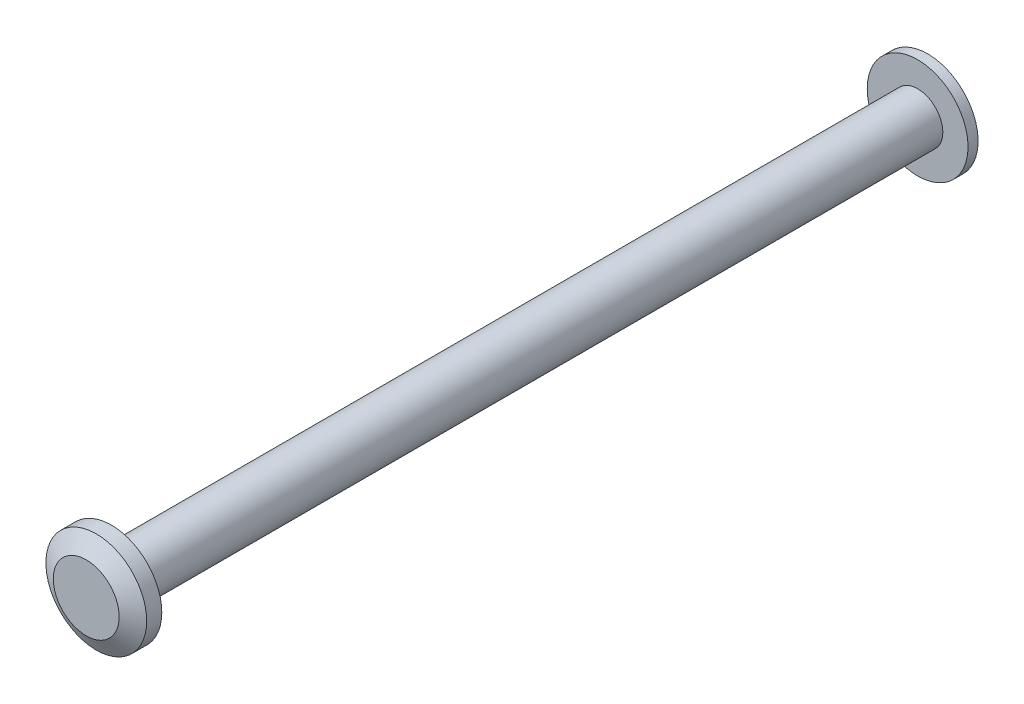
from build123d import *

# Parameters (mm, degrees)
SKETCH1_R           = 0.5
BOSS_EXTRUDE1_DEPTH = 16
SKETCH2_R           = 1
BOSS_EXTRUDE2_DEPTH = 0.4
CHAMFER1_SIZE       = 0.2
CHAMFER1_SIZE2      = 0.346410162
BOSS_EXTRUDE3_START = 0.5
SKETCH3_R           = 1
BOSS_EXTRUDE3_DEPTH = 0.5
CHAMFER2_SIZE       = 0.2
CHAMFER2_SIZE2      = 0.346410162


with BuildPart() as part:
    # Sketch1 → Boss-Extrude1 (new body)
    with BuildSketch(Plane.XY):
        Circle(SKETCH1_R)
    extrude(amount=BOSS_EXTRUDE1_DEPTH)

    # Sketch2 → Boss-Extrude2 (add)
    with BuildSketch(Plane(origin=(0, 0, 0), x_dir=(-1, 0, 0), z_dir=(0, 0, -1))):
        Circle(SKETCH2_R)
    extrude(amount=BOSS_EXTRUDE2_DEPTH)

    # Chamfer1
    chamfer1_edges = [part.edges().sort_by_distance(p)[0] for p in [
        (1, 0, -0.4),
    ]]
    chamfer1_side = [part.faces().sort_by_distance(p)[0] for p in [
        (1, 0, -0.2),
    ]]
    chamfer(chamfer1_edges, length=CHAMFER1_SIZE, length2=CHAMFER1_SIZE2, reference=chamfer1_side[0])

    # Sketch3 → Boss-Extrude3 (add)
    with BuildSketch(Plane.XY.offset(16).offset(BOSS_EXTRUDE3_START)):
        with Locations(Location((0, 0, 0), (0, 0, 180))):
            Circle(SKETCH3_R)
    extrude(amount=-BOSS_EXTRUDE3_DEPTH)

    # Chamfer2
    chamfer2_edges = [part.edges().sort_by_distance(p)[0] for p in [
        (1, 0, 16.5),
    ]]
    chamfer2_side = [part.faces().sort_by_distance(p)[0] for p in [
        (1, 0, 16.25),
    ]]
    chamfer(chamfer2_edges, length=CHAMFER2_SIZE, length2=CHAMFER2_SIZE2, reference=chamfer2_side[0])


solid = part.part
